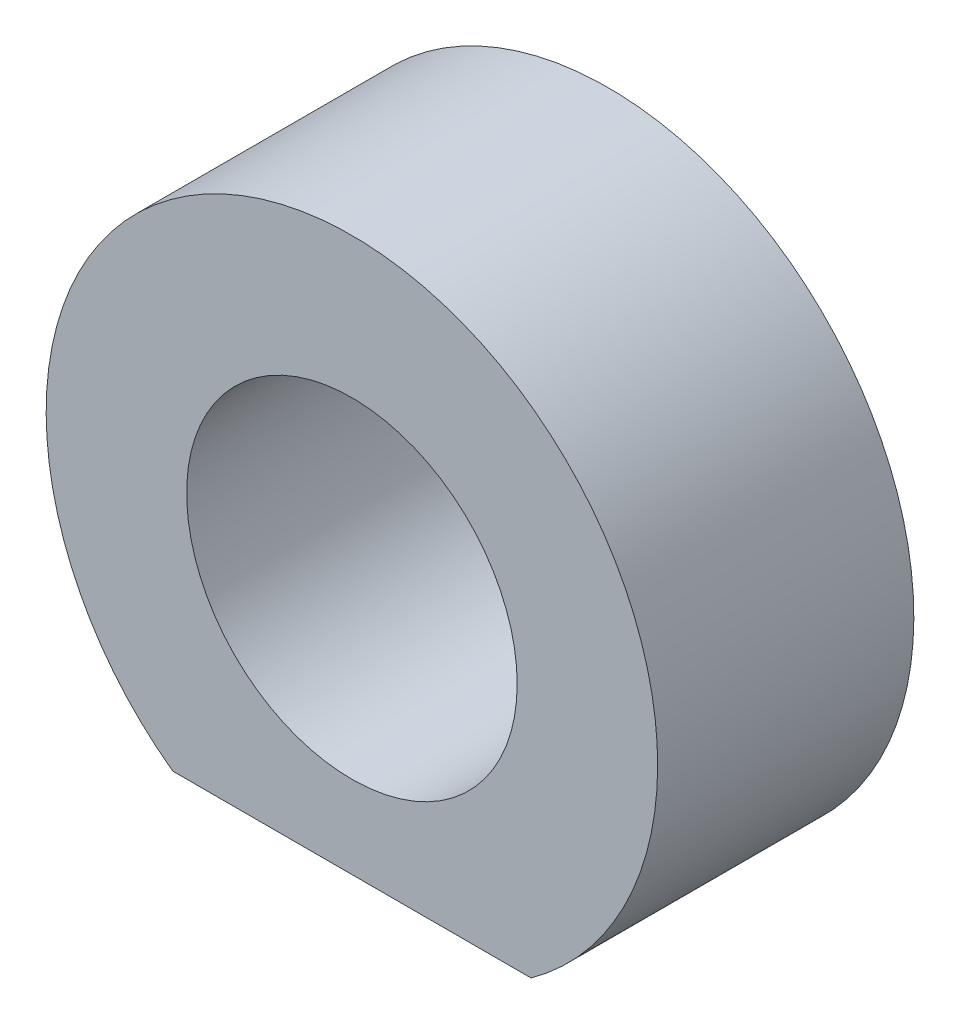
from build123d import *

# Parameters (mm, degrees)
SKETCH1_R                          = 10
BOSS_EXTRUDE1_DEPTH                = 15.5
F_2_0_2_DIAMETER_HOLE1_D           = 2
F_2_0_2_DIAMETER_HOLE1_DEPTH       = 2
F_2_0_2_DIAMETER_HOLE1_CSINK_D     = 2.05
F_2_0_2_DIAMETER_HOLE1_CSINK_ANGLE = 90
F_2_0_2_DIAMETER_HOLE1_TIP         = 0.600860619


with BuildPart() as part:
    # Sketch1 → Boss-Extrude1 (new body)
    with BuildSketch(Plane.XY):
        with BuildLine():
            Line((-10.84, -14.991477579), (10.84, -14.991477579))
            ThreePointArc((10.84, -14.991477579), (0, 18.5), (-10.84, -14.991477579))
        make_face()
        Circle(SKETCH1_R, mode=Mode.SUBTRACT)
    extrude(amount=BOSS_EXTRUDE1_DEPTH)

    # Ø2.0 (2) Diameter Hole1
    with Locations(Plane(origin=(0, -14.991477579, 0), x_dir=(-1, 0, 0), z_dir=(0, -1, 0))):
        with Locations((0, -7.75)):
            CounterSinkHole(F_2_0_2_DIAMETER_HOLE1_D / 2, F_2_0_2_DIAMETER_HOLE1_CSINK_D / 2, depth=F_2_0_2_DIAMETER_HOLE1_DEPTH, counter_sink_angle=F_2_0_2_DIAMETER_HOLE1_CSINK_ANGLE)
            with Locations((0, 0, -(F_2_0_2_DIAMETER_HOLE1_DEPTH + F_2_0_2_DIAMETER_HOLE1_TIP / 2))):  # 118° drill point
                Cone(0, F_2_0_2_DIAMETER_HOLE1_D / 2, F_2_0_2_DIAMETER_HOLE1_TIP, mode=Mode.SUBTRACT)


solid = part.part
